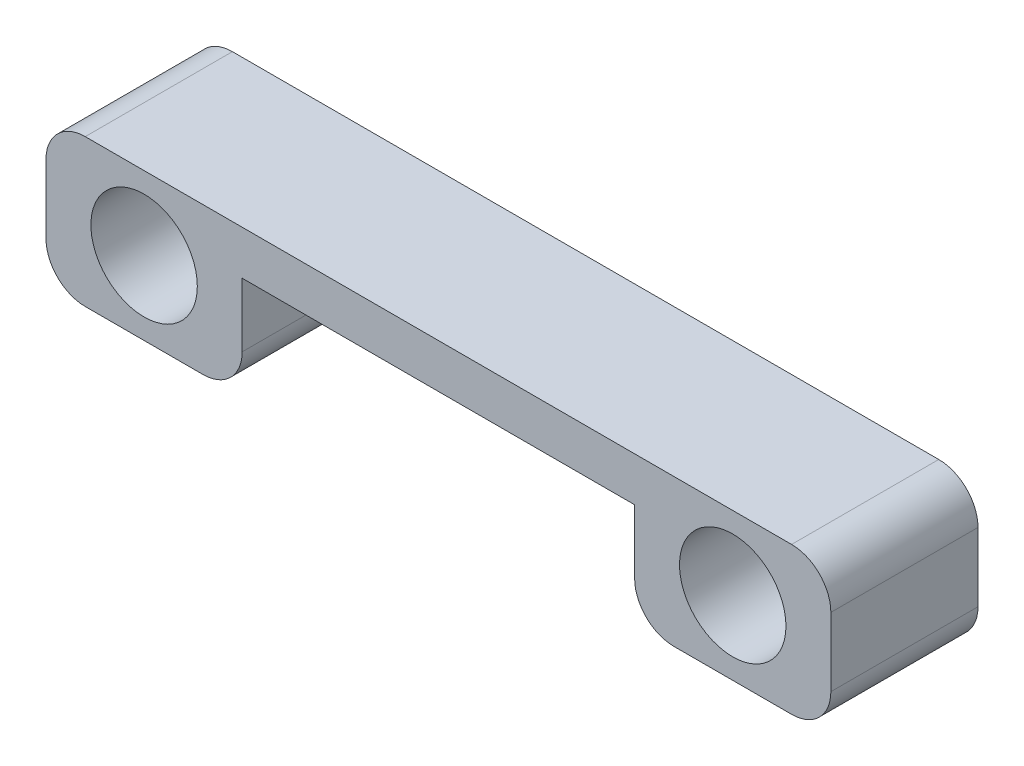
from build123d import *

# Parameters (mm, degrees)
SKETCH2_R           = 10.85
SKETCH2_W           = 80
SKETCH2_H           = 9
BOSS_EXTRUDE1_DEPTH = 30


with BuildPart() as part:
    # Sketch2 → Boss-Extrude1 (new body)
    # profile 1 of 3: a face of its own
    with BuildSketch(Plane.XY):
        with BuildLine():
            ThreePointArc((0, 8), (2.343145751, 2.343145751), (8, 0))
            Line((8, 0), (32, 0))
            ThreePointArc((32, 0), (37.656854249, 2.343145751), (40, 8))
            Line((40, 8), (40, 21))
            Line((40, 21), (40, 30))
            Line((40, 30), (8, 30))
            ThreePointArc((8, 30), (2.343145751, 27.656854249), (0, 22))
            Line((0, 22), (0, 8))
        make_face()
        with Locations((20, 15)):
            Circle(SKETCH2_R, mode=Mode.SUBTRACT)
    # profile 2 of 3: a face of its own
    with BuildSketch(Plane.XY):
        with Locations((80, 25.5)):
            Rectangle(SKETCH2_W, SKETCH2_H)
    # profile 3 of 3: a face of its own
    with BuildSketch(Plane.XY):
        with BuildLine():
            Line((120, 30), (120, 21))
            Line((120, 21), (120, 8))
            ThreePointArc((120, 8), (122.343145751, 2.343145751), (128, 0))
            Line((128, 0), (152, 0))
            ThreePointArc((152, 0), (157.656854249, 2.343145751), (160, 8))
            Line((160, 8), (160, 22))
            ThreePointArc((160, 22), (157.656854249, 27.656854249), (152, 30))
            Line((152, 30), (120, 30))
        make_face()
        with Locations((140, 15)):
            Circle(SKETCH2_R, mode=Mode.SUBTRACT)
    extrude(amount=BOSS_EXTRUDE1_DEPTH)


solid = part.part
